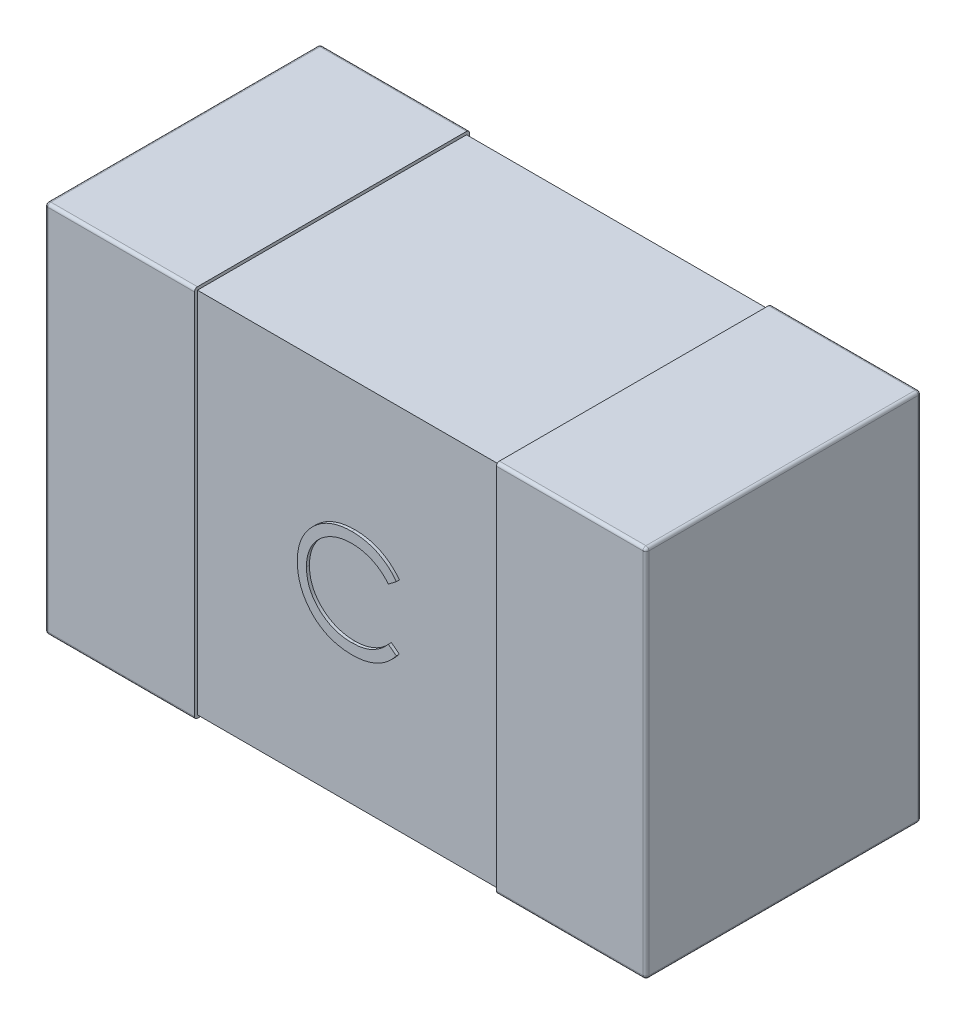
from build123d import *

# Parameters (mm, degrees)
EXTRUDE_1_DEPTH        = 0.91
EXTRUDE_1_DEPTH_BACK   = 0.01
SKETCH_3_W             = 0.5
SKETCH_3_H             = 1.25
EXTRUDE_1_2_DEPTH      = 0.91
EXTRUDE_1_2_DEPTH_BACK = 0.01
SKETCH_5_W             = 0.9
SKETCH_5_H             = 1.23
EXTRUDE_3_DEPTH        = 0.55
FILLET_3_R             = 0.01
EXTRUDE_4_DEPTH        = 0.01


with BuildPart() as part:
    # 草图3 → 凸台-拉伸1 (new, two sides: drawn at the far end of the back side and taken through both)
    with BuildSketch(Plane.XY.offset(-EXTRUDE_1_DEPTH_BACK)):
        with Locations((-0.755, 0)):
            Rectangle(SKETCH_3_W, SKETCH_3_H)
    extrude(amount=EXTRUDE_1_DEPTH + EXTRUDE_1_DEPTH_BACK)



with BuildPart() as body_2:
    # 草图3 → Extrude 1 2 (new, two sides: drawn at the far end of the back side and taken through both)
    with BuildSketch(Plane.XY.offset(-EXTRUDE_1_2_DEPTH_BACK)):
        with Locations((0.755, 0)):
            Rectangle(SKETCH_3_W, SKETCH_3_H)
    extrude(amount=EXTRUDE_1_2_DEPTH + EXTRUDE_1_2_DEPTH_BACK)


with BuildPart() as part_1:
    add(part.part)

    add(body_2.part)  # 凸台-拉伸3 merges body 2
    # 草图5 → 凸台-拉伸3 (add, symmetric)
    with BuildSketch(Plane(origin=(0, 0, 0), x_dir=(0, 0, -1), z_dir=(1, 0, 0))):
        with Locations((-0.45, 0)):
            Rectangle(SKETCH_5_W, SKETCH_5_H)
    extrude(amount=EXTRUDE_3_DEPTH, both=True)

    # 圆角3
    fillet_3_edges = [part_1.edges().sort_by_distance(p)[0] for p in [
        (-1.005, 0, -0.01),
        (-0.755, 0.625, 0.91),
        (-0.755, -0.625, -0.01),
        (-1.005, 0, 0.91),
        (-0.755, -0.625, 0.91),
        (1.005, 0.625, 0.45),
        (1.005, 0, -0.01),
        (1.005, -0.625, 0.45),
        (0.755, -0.625, -0.01),
        (0.755, 0.625, -0.01),
        (1.005, 0, 0.91),
        (0.755, 0.625, 0.91),
        (0.755, -0.625, 0.91),
        (-0.755, 0.625, -0.01),
        (-1.005, -0.625, 0.45),
        (-1.005, 0.625, 0.45),
    ]]
    fillet(fillet_3_edges, radius=FILLET_3_R)

    # 草图6 → 凸台-拉伸4 (add)
    with BuildSketch(Plane.XY.offset(0.9)):
        with BuildLine():
            Line((0.17025882, 0.113400816), (0.143560102, 0.092968124))
            add(Edge.make_bspline(
                [(0.143560102, 0.092968124), (0.14165553, 0.095237961), (0.137872064, 0.099747033), (0.13178517, 0.10607876), (0.125441582, 0.112010814), (0.118843724, 0.117571454), (0.111872838, 0.122566225), (0.104697789, 0.127255418), (0.097198551, 0.13145857), (0.086828382, 0.136554974), (0.073262591, 0.141873172), (0.056185378, 0.146332343), (0.038358586, 0.149170972), (0.026196533, 0.149478413), (0.020010423, 0.149634791)],
                knots=[0, 0, 0, 0, 0.757959112, 1.505699292, 2.245454638, 2.979532153, 3.711538275, 4.438200793, 5.171680507, 5.909471876, 7.393775596, 8.890124382, 10.418191784, 12, 12, 12, 12], degree=3))
            add(Edge.make_bspline(
                [(0.020010423, 0.149634791), (0.016602331, 0.149595548), (0.009817777, 0.149517429), (-0.000250932, 0.148486828), (-0.010131628, 0.14703831), (-0.019817885, 0.144888993), (-0.029297372, 0.142171653), (-0.038632063, 0.138924613), (-0.047686807, 0.134907285), (-0.056586864, 0.130467055), (-0.065113987, 0.125451817), (-0.073182192, 0.119981377), (-0.080762052, 0.114116951), (-0.087859563, 0.107836557), (-0.09448198, 0.101168481), (-0.100581319, 0.09404166), (-0.106136473, 0.086478877), (-0.111257556, 0.07857986), (-0.115843936, 0.070367618), (-0.119683981, 0.061811754), (-0.123084479, 0.053058784), (-0.125775262, 0.044009814), (-0.127905072, 0.034728516), (-0.129374617, 0.025189983), (-0.130393497, 0.01541414), (-0.130471228, 0.008788092), (-0.130510411, 0.005448092)],
                knots=[0, 0, 0, 0, 1.054917814, 2.100044995, 3.131103042, 4.146048494, 5.169673617, 6.183595914, 7.203665975, 8.234915748, 9.262203917, 10.264457458, 11.251630812, 12.227803204, 13.197192746, 14.159520551, 15.12972552, 16.100847026, 17.073214652, 18.039054194, 19.002613845, 19.979014051, 20.95965708, 21.949030935, 22.966165397, 24, 24, 24, 24], degree=3))
            add(Edge.make_bspline(
                [(-0.130510411, 0.005448092), (-0.130387834, 0.000422764), (-0.130147171, -0.009443802), (-0.128005333, -0.023895804), (-0.124750552, -0.037740669), (-0.119872468, -0.050891854), (-0.113857474, -0.063511523), (-0.106256958, -0.075386155), (-0.097454208, -0.086695192), (-0.087324693, -0.097171364), (-0.076210985, -0.106741269), (-0.064286903, -0.115168468), (-0.051582143, -0.122193343), (-0.038236985, -0.128039006), (-0.024148734, -0.132532517), (-0.009342724, -0.135695889), (0.006148841, -0.137759415), (0.01673444, -0.137956973), (0.022121801, -0.138057517)],
                knots=[0, 0, 0, 0, 1.029171465, 2.020641659, 2.987623507, 3.938342917, 4.889210282, 5.84687017, 6.821220943, 7.821438502, 8.827599549, 9.822697543, 10.807740252, 11.797342354, 12.80366471, 13.83203677, 14.896651826, 16, 16, 16, 16], degree=3))
            add(Edge.make_bspline(
                [(0.022121801, -0.138057517), (0.028057491, -0.137893464), (0.039740348, -0.137570569), (0.056873242, -0.134835099), (0.073274431, -0.130399758), (0.088944796, -0.124192532), (0.103840162, -0.116123332), (0.117983838, -0.106341253), (0.131387762, -0.094753243), (0.139447829, -0.085905168), (0.143560102, -0.08139085)],
                knots=[0, 0, 0, 0, 1.028121516, 2.023589091, 2.998037872, 3.967518031, 4.937445131, 5.927275754, 6.942489185, 8, 8, 8, 8], degree=3))
            Line((0.143560102, -0.08139085), (0.17025882, -0.101619216))
            add(Edge.make_bspline(
                [(0.17025882, -0.101619216), (0.168110204, -0.104391523), (0.163823263, -0.109922857), (0.156881627, -0.11772068), (0.149568975, -0.125055358), (0.141830992, -0.131867755), (0.133756692, -0.138294189), (0.125201096, -0.144152081), (0.116276676, -0.149523196), (0.107013669, -0.15444124), (0.097421918, -0.15880463), (0.087512916, -0.162540139), (0.077329374, -0.165757985), (0.066870828, -0.168405316), (0.056115583, -0.17047165), (0.045102451, -0.17185299), (0.033807663, -0.172799347), (0.02618764, -0.172885602), (0.022326128, -0.172929312)],
                knots=[0, 0, 0, 0, 0.986787822, 1.968848986, 2.935600012, 3.899624008, 4.868462664, 5.837806735, 6.815139263, 7.798259679, 8.787526145, 9.778297419, 10.776456485, 11.791383307, 12.812564526, 13.85620153, 14.913611965, 16, 16, 16, 16], degree=3))
            add(Edge.make_bspline(
                [(0.022326128, -0.172929312), (0.018669315, -0.172903861), (0.011438419, -0.172853536), (0.00076254, -0.172038297), (-0.009630733, -0.170926036), (-0.019711697, -0.169251281), (-0.029535363, -0.167274974), (-0.039012677, -0.164625766), (-0.048236898, -0.161658132), (-0.057170965, -0.158170219), (-0.065822479, -0.154234362), (-0.074163535, -0.149786039), (-0.082190297, -0.144862658), (-0.08998168, -0.139572742), (-0.097422588, -0.133746376), (-0.104577502, -0.127464474), (-0.111486543, -0.12074821), (-0.115761089, -0.115905167), (-0.11791025, -0.113470177)],
                knots=[0, 0, 0, 0, 1.114604814, 2.203992996, 3.262667896, 4.300477797, 5.318619304, 6.316056647, 7.298880507, 8.271930387, 9.238335007, 10.195173496, 11.151986948, 12.108099108, 13.064862484, 14.031167946, 15.010108607, 16, 16, 16, 16], degree=3))
            add(Edge.make_bspline(
                [(-0.11791025, -0.113470177), (-0.12135257, -0.109240462), (-0.128195651, -0.100832096), (-0.136950717, -0.087204315), (-0.144445051, -0.072975974), (-0.150504426, -0.058072324), (-0.155241377, -0.042526807), (-0.158522979, -0.026331585), (-0.160655421, -0.009501785), (-0.160899277, 0.001945217), (-0.161023231, 0.007763797)],
                knots=[0, 0, 0, 0, 0.994628077, 1.977248131, 2.950237994, 3.925870899, 4.908910175, 5.911660606, 6.938484602, 8, 8, 8, 8], degree=3))
            add(Edge.make_bspline(
                [(-0.161023231, 0.007763797), (-0.160872155, 0.01387947), (-0.160574923, 0.025911674), (-0.158049617, 0.043569715), (-0.153987219, 0.060487279), (-0.148217236, 0.076632786), (-0.140901859, 0.092091156), (-0.131864988, 0.106744302), (-0.121211608, 0.120685934), (-0.109025273, 0.133704509), (-0.095661589, 0.145608332), (-0.081350619, 0.156080935), (-0.066120372, 0.164796351), (-0.050138638, 0.172081692), (-0.033285744, 0.17768144), (-0.015597645, 0.181601464), (0.002892421, 0.184041412), (0.015507628, 0.184349861), (0.021917474, 0.184506585)],
                knots=[0, 0, 0, 0, 1.032925535, 2.032216505, 3.007276963, 3.968222605, 4.92396291, 5.891752235, 6.871517503, 7.883894988, 8.900124299, 9.891468569, 10.874487609, 11.85992873, 12.854644235, 13.869047385, 14.917252991, 16, 16, 16, 16], degree=3))
            add(Edge.make_bspline(
                [(0.021917474, 0.184506585), (0.025824023, 0.184459749), (0.033556643, 0.184367041), (0.044995472, 0.183463016), (0.056132155, 0.18195598), (0.066974364, 0.179904705), (0.077574847, 0.177358851), (0.087852585, 0.174042365), (0.097867886, 0.170250244), (0.107557586, 0.165882851), (0.116875193, 0.160980367), (0.125817807, 0.155597135), (0.134314393, 0.149739828), (0.142424739, 0.143458263), (0.150013171, 0.136619546), (0.157295143, 0.129411779), (0.164023362, 0.12162735), (0.168176529, 0.116148014), (0.17025882, 0.113400816)],
                knots=[0, 0, 0, 0, 1.096760587, 2.17092713, 3.219439832, 4.250915756, 5.268269357, 6.278326846, 7.281116186, 8.274029601, 9.260640565, 10.235837813, 11.203064059, 12.156899882, 13.114053108, 14.069676657, 15.032185724, 16, 16, 16, 16], degree=3))
        make_face()
    extrude(amount=EXTRUDE_4_DEPTH)


solid = part_1.part
